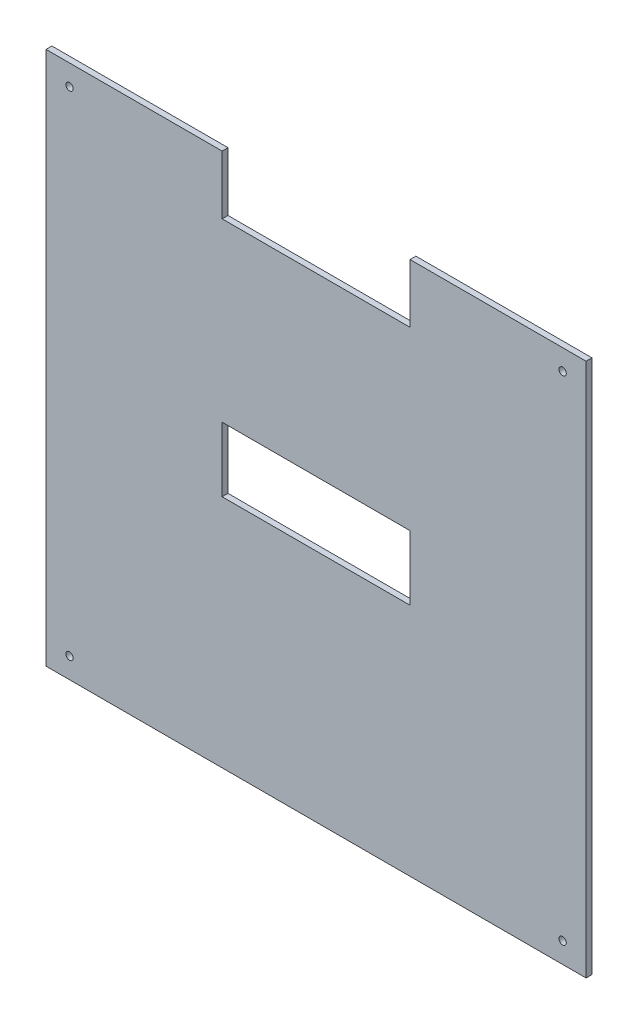
from build123d import *

# Parameters (mm, degrees)
SKETCH_1_W          = 184
SKETCH_1_H          = 182
EXTRUDE_1_DEPTH     = 2
M3X0_5_1_D          = 2.5
SKETCH_4_W          = 64
SKETCH_4_H          = 20
CUT_EXTRUDE_1_DEPTH = 259.812673569
SKETCH_6_W          = 64
SKETCH_6_H          = 22
CUT_EXTRUDE_2_DEPTH = 10


with BuildPart() as part:
    # ｽｹｯﾁ1 → ﾎﾞｽ - 押し出し1 (new body)
    with BuildSketch(Plane.XY):
        with Locations((92, 91)):
            Rectangle(SKETCH_1_W, SKETCH_1_H)
    extrude(amount=EXTRUDE_1_DEPTH)

    # M3x0.5 ねじ穴1 (through all)
    with Locations(Plane.XY.offset(2)):
        with Locations((8, 175), (8, 7), (176, 7), (176, 175)):
            Hole(M3X0_5_1_D / 2)

    # ｽｹｯﾁ4 → ｶｯﾄ - 押し出し1 (cut, through all)
    with BuildSketch(Plane(origin=(0, 0, 0), x_dir=(-1, 0, 0), z_dir=(0, 0, -1))):
        with Locations((-92, 172)):
            Rectangle(SKETCH_4_W, SKETCH_4_H)
    extrude(amount=-CUT_EXTRUDE_1_DEPTH, mode=Mode.SUBTRACT)

    # ｽｹｯﾁ6 → ｶｯﾄ - 押し出し2 (cut)
    with BuildSketch(Plane(origin=(0, 0, 0), x_dir=(-1, 0, 0), z_dir=(0, 0, -1))):
        with Locations((-92, 91)):
            Rectangle(SKETCH_6_W, SKETCH_6_H)
    extrude(amount=-CUT_EXTRUDE_2_DEPTH, mode=Mode.SUBTRACT)


solid = part.part
